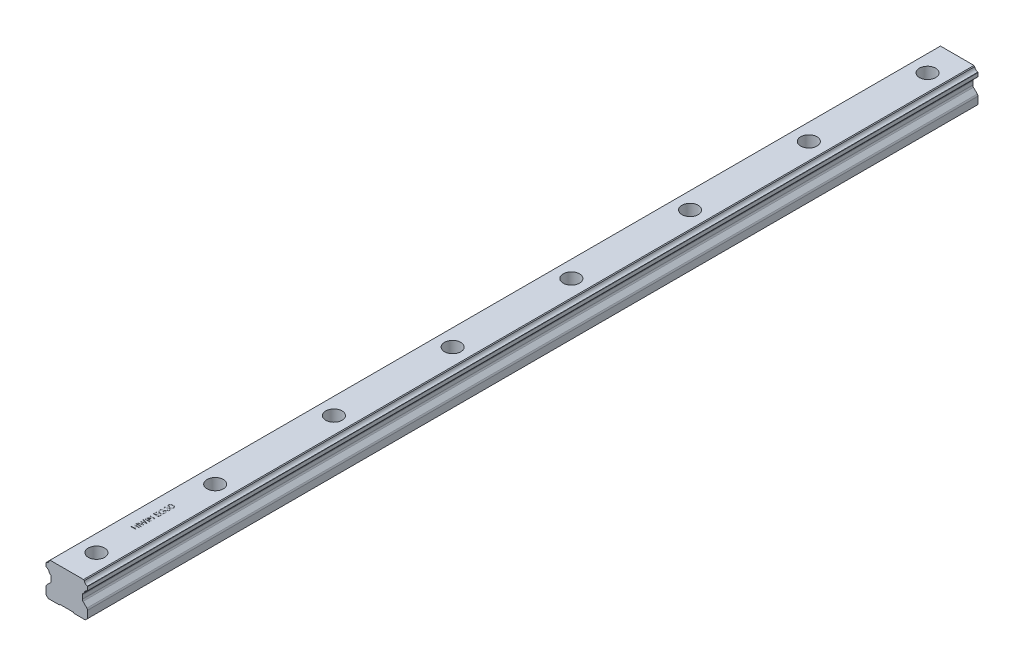
from build123d import *

# Parameters (mm, degrees)
EXTRUDE_1_DEPTH              = 600
HOLE_WIZARD_M6_1_D           = 7
HOLE_WIZARD_M6_1_CBORE_D     = 11
HOLE_WIZARD_M6_1_CBORE_DEPTH = 9
PATTERN_LINEAR_1_COUNT       = 8
PATTERN_LINEAR_1_PITCH       = 80
SKETCH_6_W                   = 3.5
SKETCH_6_H                   = 0.314102564
CUT_EXTRUDE_1_DEPTH          = 0.1


with BuildPart() as part:
    # 草图1 → 凸台-拉伸1 (new body)
    with BuildSketch(Plane.XY):
        with BuildLine():
            Line((-5, 0), (-4.5, 0.5))
            Line((-4.5, 0.5), (4.5, 0.5))
            Line((4.5, 0.5), (5, 0))
            Line((5, 0), (12.5, 0))
            Line((12.5, 0), (14, 1.5))
            Line((14, 1.5), (14, 6.378679656))
            ThreePointArc((14, 6.378679656), (13.885819299, 6.952704802), (13.56066018, 7.43933983))
            Line((13.56066018, 7.43933983), (10.939339837, 10.060660173))
            ThreePointArc((10.939339837, 10.060660173), (10.61418071, 10.547295197), (10.500000009, 11.121320345))
            Line((10.500000009, 11.121320345), (10.500000009, 13.578679658))
            ThreePointArc((10.500000009, 13.578679658), (10.614180701, 14.152704808), (10.939339828, 14.639339831))
            Line((10.939339828, 14.639339831), (11.758193653, 15.458193656))
            ThreePointArc((11.758193653, 15.458193656), (11.768448169, 15.468969732), (11.778155914, 15.480240872))
            ThreePointArc((11.778155914, 15.480240872), (12.478076595, 16.902541614), (13.892618036, 17.618014096))
            ThreePointArc((13.892618036, 17.618014096), (13.971832127, 17.721095866), (14, 17.848010383))
            Line((14, 17.848010383), (14, 20.151989624))
            ThreePointArc((14, 20.151989624), (13.971832127, 20.27890414), (13.892618036, 20.381985911))
            ThreePointArc((13.892618036, 20.381985911), (12.478076601, 21.097458394), (11.778155922, 22.519759133))
            ThreePointArc((11.778155922, 22.519759133), (11.768448178, 22.531030273), (11.758193661, 22.541806349))
            Line((11.758193661, 22.541806349), (11.300000009, 23.000000002))
            Line((11.300000009, 23.000000002), (-11.300000009, 23.000000002))
            Line((-11.300000009, 23.000000002), (-11.758193661, 22.541806349))
            ThreePointArc((-11.758193661, 22.541806349), (-11.768448178, 22.531030273), (-11.778155922, 22.519759133))
            ThreePointArc((-11.778155922, 22.519759133), (-12.478076604, 21.097458391), (-13.892618045, 20.381985909))
            ThreePointArc((-13.892618045, 20.381985909), (-13.971832136, 20.278904139), (-14.000000009, 20.151989622))
            Line((-14.000000009, 20.151989622), (-14.000000009, 17.848010381))
            ThreePointArc((-14.000000009, 17.848010381), (-13.971832136, 17.721095864), (-13.892618045, 17.618014094))
            ThreePointArc((-13.892618045, 17.618014094), (-12.478076604, 16.902541612), (-11.778155922, 15.480240871))
            ThreePointArc((-11.778155922, 15.480240871), (-11.768448178, 15.46896973), (-11.758193661, 15.458193654))
            Line((-11.758193661, 15.458193654), (-10.939339837, 14.63933983))
            ThreePointArc((-10.939339837, 14.63933983), (-10.61418071, 14.152704807), (-10.500000009, 13.578679658))
            Line((-10.500000009, 13.578679658), (-10.500000009, 11.121320345))
            ThreePointArc((-10.500000009, 11.121320345), (-10.614180701, 10.547295196), (-10.939339828, 10.060660172))
            Line((-10.939339828, 10.060660172), (-13.560660172, 7.439339828))
            ThreePointArc((-13.560660172, 7.439339828), (-13.885819299, 6.952704805), (-14, 6.378679656))
            Line((-14, 6.378679656), (-14, 1.5))
            Line((-14, 1.5), (-12.5, 0))
            Line((-12.5, 0), (-5, 0))
        make_face()
    extrude(amount=-EXTRUDE_1_DEPTH)

    # M6 六角凹头螺钉的柱形沉头孔1 (through all)
    with Locations(Plane(origin=(-2.187067447, 23.000000002, -4.078813807), x_dir=(-1, 0, 0), z_dir=(0, 1, 0))):
        with Locations((-2.187067447, -15.921186193)):
            hole_wizard_m6_1 = CounterBoreHole(HOLE_WIZARD_M6_1_D / 2, HOLE_WIZARD_M6_1_CBORE_D / 2, HOLE_WIZARD_M6_1_CBORE_DEPTH)

    # 阵列(线性)1: M6 六角凹头螺钉的柱形沉头孔1 ×8
    with Locations(*[(0, 0, -i * PATTERN_LINEAR_1_PITCH) for i in range(1, PATTERN_LINEAR_1_COUNT)]):
        add(hole_wizard_m6_1, mode=Mode.SUBTRACT)

    # 草图6 → 切除-拉伸1 (cut)
    # profile 1 of 9: a face of its own
    with BuildSketch(Plane(origin=(0, 23.000000002, 0), x_dir=(1, 0, 0), z_dir=(0, 1, 0))):
        Polygon((-3.5, 46.762820513), (-3.5, 47.076923077), (-2.064102564, 47.076923077), (-2.064102564, 48.871794872), (-3.5, 48.871794872), (-3.5, 49.185897436), (0, 49.185897436), (0, 48.871794872), (-1.705128205, 48.871794872), (-1.705128205, 47.076923077), (0, 47.076923077), (0, 46.762820513), align=None)
    # profile 2 of 9: a face of its own
    with BuildSketch(Plane(origin=(0, 23.000000002, 0), x_dir=(1, 0, 0), z_dir=(0, 1, 0))):
        with Locations((-1.75, 50.240384615)):
            Rectangle(SKETCH_6_W, SKETCH_6_H)
    # profile 3 of 9: a face of its own
    with BuildSketch(Plane(origin=(0, 23.000000002, 0), x_dir=(1, 0, 0), z_dir=(0, 1, 0))):
        Polygon((-3.5, 50.935897436), (-3.5, 51.260516827), (-0.933193109, 51.945512821), (-3.5, 52.964242788), (-3.5, 53.009815705), (-0.950721154, 54.009615385), (-3.5, 54.698116987), (-3.5, 55.019230769), (0, 54.075520833), (0, 54.030649038), (-2.676883013, 52.977564103), (0, 51.911858974), (0, 51.866987179), align=None)
    # profile 4 of 9: a face of its own
    with BuildSketch(Plane(origin=(0, 23.000000002, 0), x_dir=(1, 0, 0), z_dir=(0, 1, 0))):
        with Locations((-1.75, 55.983974359)):
            Rectangle(SKETCH_6_W, SKETCH_6_H)
    # profile 5 of 9: a face of its own
    with BuildSketch(Plane(origin=(0, 23.000000002, 0), x_dir=(1, 0, 0), z_dir=(0, 1, 0))):
        Polygon((0, 56.903846154), (-3.5, 56.903846154), (-3.5, 56.969751603), (-0.745292468, 59.282051282), (-3.5, 59.282051282), (-3.5, 59.596153846), (0, 59.596153846), (0, 59.524639423), (-2.748397436, 57.217948718), (0, 57.217948718), align=None)
    # profile 6 of 9: a face of its own
    with BuildSketch(Plane(origin=(0, 23.000000002, 0), x_dir=(1, 0, 0), z_dir=(0, 1, 0))):
        Polygon((-3.5, 61.83974359), (-3.5, 63.814102564), (-3.141025641, 63.814102564), (-3.141025641, 62.153846154), (-2.064102564, 62.153846154), (-2.064102564, 63.814102564), (-1.705128205, 63.814102564), (-1.705128205, 62.153846154), (-0.358974359, 62.153846154), (-0.358974359, 63.814102564), (0, 63.814102564), (0, 61.83974359), align=None)
    # profile 7 of 9: a face of its own
    with BuildSketch(Plane(origin=(0, 23.000000002, 0), x_dir=(1, 0, 0), z_dir=(0, 1, 0))):
        with BuildLine():
            Line((-2.902644231, 67.717948718), (-2.647435897, 67.448717949))
            add(Edge.make_bspline(
                [(-2.647435897, 67.448717949), (-2.69328212, 67.400008868), (-2.783881335, 67.303752203), (-2.901244074, 67.146552261), (-3.002777003, 66.983196408), (-3.084772592, 66.813420508), (-3.149094254, 66.641676508), (-3.195850217, 66.470917554), (-3.225460377, 66.302249256), (-3.229016796, 66.190084954), (-3.230769231, 66.134815705)],
                knots=[0, 0, 0, 0, 1.089067066, 2.152164705, 3.18986567, 4.218445106, 5.218487318, 6.173592265, 7.100032889, 8, 8, 8, 8], degree=3))
            add(Edge.make_bspline(
                [(-3.230769231, 66.134815705), (-3.230355625, 66.100901005), (-3.229529486, 66.033159565), (-3.218985271, 65.932537621), (-3.203820407, 65.832970983), (-3.181878529, 65.734647609), (-3.15406947, 65.637376321), (-3.119284004, 65.541495434), (-3.078728771, 65.446826062), (-3.031866252, 65.354260043), (-2.980386575, 65.26451931), (-2.923337414, 65.179763314), (-2.862550889, 65.099446852), (-2.796491613, 65.025097645), (-2.725807311, 64.956221131), (-2.651770944, 64.89155043), (-2.572926872, 64.832290852), (-2.489599321, 64.779505212), (-2.403726867, 64.731837618), (-2.316037795, 64.690645418), (-2.227346143, 64.654835464), (-2.136984078, 64.627561503), (-2.045883197, 64.604460629), (-1.953566086, 64.588379393), (-1.859791669, 64.579283076), (-1.796993971, 64.577712585), (-1.765424679, 64.576923077)],
                knots=[0, 0, 0, 0, 1.028150113, 2.053633673, 3.06513288, 4.081487945, 5.106702018, 6.131327874, 7.172780699, 8.228344599, 9.276313556, 10.308389736, 11.324843658, 12.329040066, 13.321460474, 14.316307835, 15.308626991, 16.309440696, 17.305625405, 18.28535951, 19.246194545, 20.203493668, 21.145557131, 22.095268976, 23.042464743, 24, 24, 24, 24], degree=3))
            add(Edge.make_bspline(
                [(-1.765424679, 64.576923077), (-1.733154018, 64.577679272), (-1.668700816, 64.579189598), (-1.572504414, 64.588842795), (-1.477747832, 64.606798005), (-1.384282029, 64.630609755), (-1.291920993, 64.66088243), (-1.20076111, 64.698074944), (-1.110811241, 64.742381076), (-1.022964324, 64.793552345), (-0.937464192, 64.850061813), (-0.856251713, 64.912212997), (-0.780271995, 64.980110534), (-0.708415252, 65.052509477), (-0.641134974, 65.130069473), (-0.579242122, 65.213543005), (-0.521779643, 65.301761597), (-0.469378807, 65.394764386), (-0.42257144, 65.491568366), (-0.38094723, 65.590824797), (-0.346667976, 65.692852699), (-0.31872985, 65.797115365), (-0.295829559, 65.903488643), (-0.281097077, 66.012512444), (-0.270406246, 66.123385153), (-0.269624576, 66.198123785), (-0.269230769, 66.235777244)],
                knots=[0, 0, 0, 0, 0.935915162, 1.869274651, 2.799799983, 3.730201895, 4.664668062, 5.616159355, 6.583070886, 7.570012957, 8.562524459, 9.553461134, 10.53281078, 11.515274572, 12.509912756, 13.507571325, 14.526460018, 15.561318395, 16.601025881, 17.643204557, 18.680545676, 19.719612342, 20.772381578, 21.833430283, 22.908478249, 24, 24, 24, 24], degree=3))
            add(Edge.make_bspline(
                [(-0.269230769, 66.235777244), (-0.270178952, 66.281155776), (-0.272040863, 66.370263896), (-0.286546735, 66.501247716), (-0.309173205, 66.627060334), (-0.342412256, 66.747292172), (-0.384484705, 66.862379567), (-0.436513285, 66.971898055), (-0.497950569, 67.076150049), (-0.567552463, 67.174684309), (-0.645100929, 67.26515833), (-0.728035637, 67.347500409), (-0.817431068, 67.418879031), (-0.911954918, 67.481426348), (-1.012511326, 67.533123592), (-1.118540888, 67.57556947), (-1.230109213, 67.608101926), (-1.307200733, 67.621457015), (-1.346153846, 67.628205128)],
                knots=[0, 0, 0, 0, 1.130199668, 2.219330667, 3.279027493, 4.311506524, 5.322739849, 6.327972234, 7.327472899, 8.33386792, 9.329086447, 10.29244429, 11.240784345, 12.174119183, 13.111530729, 14.052100829, 15.015757696, 16, 16, 16, 16], degree=3))
            Line((-1.346153846, 67.628205128), (-1.346153846, 66.461538462))
            Line((-1.346153846, 66.461538462), (-1.705128205, 66.461538462))
            Line((-1.705128205, 66.461538462), (-1.705128205, 67.942307692))
            add(Edge.make_bspline(
                [(-1.705128205, 67.942307692), (-1.638220716, 67.940601844), (-1.507270675, 67.937263191), (-1.316300404, 67.913844275), (-1.13592871, 67.876027763), (-0.965965639, 67.824367451), (-0.806652046, 67.75749217), (-0.65782618, 67.676119642), (-0.520449499, 67.578947521), (-0.393400495, 67.469437079), (-0.280071283, 67.346537122), (-0.180465345, 67.213568502), (-0.09656273, 67.070311533), (-0.028302067, 66.916901726), (0.024971927, 66.753841292), (0.062743504, 66.580752913), (0.085373467, 66.397871312), (0.088264847, 66.272534635), (0.08974359, 66.208433494)],
                knots=[0, 0, 0, 0, 1.140356446, 2.231883559, 3.274166699, 4.278491846, 5.25512956, 6.21435461, 7.1637429, 8.11826594, 9.068280886, 10.0076534, 10.945064095, 11.891975133, 12.864533718, 13.863980011, 14.907571808, 16, 16, 16, 16], degree=3))
            add(Edge.make_bspline(
                [(0.08974359, 66.208433494), (0.089174469, 66.168923358), (0.088051978, 66.090996637), (0.080074631, 65.975905709), (0.067794054, 65.863988089), (0.049248931, 65.75526008), (0.026534277, 65.649321738), (-0.002552442, 65.546702153), (-0.036221141, 65.447010411), (-0.074516815, 65.350092425), (-0.118888472, 65.256827878), (-0.168198111, 65.166801361), (-0.222191472, 65.079515236), (-0.281802318, 64.995564071), (-0.346584778, 64.914510449), (-0.416668697, 64.836877005), (-0.491839816, 64.762229127), (-0.545218826, 64.715468664), (-0.572115385, 64.691907051)],
                knots=[0, 0, 0, 0, 1.107784379, 2.184907829, 3.233506516, 4.263428166, 5.276301166, 6.270063455, 7.25232949, 8.225834625, 9.190232166, 10.146266622, 11.1027726, 12.066435141, 13.031522626, 14.010570082, 14.99756817, 16, 16, 16, 16], degree=3))
            add(Edge.make_bspline(
                [(-0.572115385, 64.691907051), (-0.614786038, 64.657721119), (-0.699419055, 64.589916707), (-0.835018999, 64.50263855), (-0.975420859, 64.428237147), (-1.121015488, 64.367869325), (-1.271666701, 64.320731239), (-1.427181992, 64.286924986), (-1.587761622, 64.267117697), (-1.696426887, 64.264264159), (-1.751402244, 64.262820513)],
                knots=[0, 0, 0, 0, 1.023165419, 2.029347347, 3.013907458, 3.994755782, 4.975994455, 5.96558838, 6.970761222, 8, 8, 8, 8], degree=3))
            add(Edge.make_bspline(
                [(-1.751402244, 64.262820513), (-1.792568496, 64.263352751), (-1.874377804, 64.264410462), (-1.99583511, 64.27723598), (-2.115135808, 64.295637392), (-2.232182344, 64.322684468), (-2.347053012, 64.356780654), (-2.45980069, 64.399334435), (-2.570493643, 64.448878213), (-2.67836343, 64.50646793), (-2.782003044, 64.570536667), (-2.880905313, 64.640144323), (-2.973467332, 64.715828008), (-3.059903521, 64.797808103), (-3.141494975, 64.884432033), (-3.216537375, 64.977518334), (-3.286205011, 65.07565667), (-3.349159221, 65.17960781), (-3.405727075, 65.287731441), (-3.455315154, 65.399792527), (-3.496298775, 65.515750345), (-3.531072472, 65.634737902), (-3.556787635, 65.757655381), (-3.575436374, 65.883610924), (-3.588196976, 66.013261034), (-3.589223231, 66.100897064), (-3.58974359, 66.145332532)],
                knots=[0, 0, 0, 0, 1.00895651, 2.005089799, 2.991467152, 3.967318338, 4.948153826, 5.927364234, 6.919980553, 7.91976625, 8.923240147, 9.905815003, 10.88314567, 11.851989312, 12.825009789, 13.798721852, 14.781296708, 15.773896486, 16.776076962, 17.771600213, 18.775744723, 19.78957137, 20.808953803, 21.851964491, 22.910847925, 24, 24, 24, 24], degree=3))
            add(Edge.make_bspline(
                [(-3.58974359, 66.145332532), (-3.589164098, 66.181570776), (-3.588015034, 66.253426954), (-3.580050386, 66.360352687), (-3.567426505, 66.465625701), (-3.550199718, 66.569402091), (-3.526736028, 66.671328458), (-3.498657743, 66.771695163), (-3.46596592, 66.870647699), (-3.426977074, 66.967875948), (-3.382723449, 67.064033664), (-3.332910027, 67.159655505), (-3.276685022, 67.254414751), (-3.213881487, 67.348475732), (-3.145578069, 67.44243159), (-3.069821245, 67.534796233), (-2.989598489, 67.627799177), (-2.931916305, 67.687600991), (-2.902644231, 67.717948718)],
                knots=[0, 0, 0, 0, 0.985871117, 1.954866573, 2.915460327, 3.869826059, 4.81536089, 5.759505086, 6.70452669, 7.649098992, 8.607881297, 9.583363685, 10.581137262, 11.603961102, 12.659522466, 13.73993555, 14.853081303, 16, 16, 16, 16], degree=3))
        make_face()
    # profile 8 of 9: a face of its own
    with BuildSketch(Plane(origin=(0, 23.000000002, 0), x_dir=(1, 0, 0), z_dir=(0, 1, 0))):
        with BuildLine():
            Line((-2.692307692, 68.794871795), (-2.692307692, 68.480769231))
            add(Edge.make_bspline(
                [(-2.692307692, 68.480769231), (-2.727540176, 68.489278781), (-2.796416801, 68.505914257), (-2.894824062, 68.54061183), (-2.987947583, 68.578411086), (-3.074043657, 68.62380019), (-3.154842559, 68.673308944), (-3.228511684, 68.730031666), (-3.296924649, 68.791351389), (-3.357637887, 68.859176338), (-3.412615616, 68.930305), (-3.459490673, 69.005739619), (-3.499814826, 69.083962513), (-3.533035058, 69.165515646), (-3.558060582, 69.250641818), (-3.576217387, 69.338571441), (-3.588008502, 69.429534941), (-3.589159265, 69.491282532), (-3.58974359, 69.522636218)],
                knots=[0, 0, 0, 0, 1.162005537, 2.271625781, 3.343758855, 4.383309926, 5.390229558, 6.379919256, 7.361854164, 8.333198761, 9.295911338, 10.242430842, 11.177959212, 12.116337295, 13.062827104, 14.020064771, 14.994644689, 16, 16, 16, 16], degree=3))
            add(Edge.make_bspline(
                [(-3.58974359, 69.522636218), (-3.588364359, 69.56831896), (-3.585635984, 69.658687971), (-3.560721548, 69.791451018), (-3.521296415, 69.919477837), (-3.466822688, 70.041367085), (-3.399635375, 70.154585517), (-3.319670638, 70.255321704), (-3.228471337, 70.342210215), (-3.127738772, 70.415104593), (-3.020083263, 70.472179592), (-2.909283106, 70.514265965), (-2.795601134, 70.539887646), (-2.718843855, 70.543208203), (-2.680388622, 70.544871795)],
                knots=[0, 0, 0, 0, 1.083050992, 2.142477498, 3.193116406, 4.255571735, 5.30263384, 6.308962982, 7.297363603, 8.282367274, 9.249857812, 10.179914175, 11.08814088, 12, 12, 12, 12], degree=3))
            add(Edge.make_bspline(
                [(-2.680388622, 70.544871795), (-2.643381827, 70.543708204), (-2.570965273, 70.541431237), (-2.465243775, 70.522097531), (-2.365602175, 70.489561268), (-2.271621013, 70.444491506), (-2.183896173, 70.386149955), (-2.102230282, 70.315477259), (-2.026261124, 70.231974597), (-1.982741651, 70.168695659), (-1.960336538, 70.136117788)],
                knots=[0, 0, 0, 0, 1.024540389, 2.004866551, 2.965041327, 3.920577974, 4.882998113, 5.874504559, 6.905732034, 8, 8, 8, 8], degree=3))
            add(Edge.make_bspline(
                [(-1.960336538, 70.136117788), (-1.942423541, 70.173397), (-1.906875194, 70.247377602), (-1.836051735, 70.347199024), (-1.75628694, 70.439197511), (-1.693344586, 70.489900293), (-1.661658654, 70.515424679)],
                knots=[0, 0, 0, 0, 1.015663554, 2.015584519, 3.001021554, 4, 4, 4, 4], degree=3))
            add(Edge.make_bspline(
                [(-1.661658654, 70.515424679), (-1.638600902, 70.532266022), (-1.592862986, 70.565672918), (-1.51932656, 70.606908452), (-1.444975071, 70.644317566), (-1.367815664, 70.673467785), (-1.288742651, 70.696041652), (-1.207620255, 70.712177684), (-1.124382232, 70.722201825), (-1.068069752, 70.723637377), (-1.039763622, 70.724358974)],
                knots=[0, 0, 0, 0, 1.025084078, 2.033381695, 3.024893161, 4.013698104, 4.991890475, 5.976764909, 6.982997093, 8, 8, 8, 8], degree=3))
            add(Edge.make_bspline(
                [(-1.039763622, 70.724358974), (-0.990754151, 70.722564202), (-0.892965849, 70.718983104), (-0.74848737, 70.686982909), (-0.60727652, 70.637354543), (-0.47214511, 70.566956002), (-0.345832955, 70.480771863), (-0.231982837, 70.379372435), (-0.135655914, 70.261308087), (-0.054197152, 70.130857678), (0.01031173, 69.988918727), (0.056807387, 69.837723782), (0.084695443, 69.678147828), (0.088041716, 69.56902181), (0.08974359, 69.513521635)],
                knots=[0, 0, 0, 0, 0.955697303, 1.906897079, 2.875188111, 3.870982192, 4.871999088, 5.854111427, 6.836107184, 7.836239895, 8.848948182, 9.870701427, 10.917064451, 12, 12, 12, 12], degree=3))
            add(Edge.make_bspline(
                [(0.08974359, 69.513521635), (0.088867804, 69.47610469), (0.087144549, 69.402480619), (0.075573795, 69.294203576), (0.053866216, 69.191067092), (0.02656593, 69.092069671), (-0.011179774, 68.998705424), (-0.056179646, 68.909631395), (-0.109587649, 68.825238025), (-0.171493598, 68.7460265), (-0.240788051, 68.672081446), (-0.318622183, 68.60528674), (-0.403543338, 68.544903367), (-0.496315397, 68.491314997), (-0.596678518, 68.444296096), (-0.705034874, 68.404858517), (-0.820544439, 68.370424638), (-0.901018589, 68.354383909), (-0.942307692, 68.346153846)],
                knots=[0, 0, 0, 0, 1.048603596, 2.063302207, 3.045874044, 3.999447474, 4.937100059, 5.862643889, 6.7929026, 7.7308982, 8.676022965, 9.627908155, 10.600123445, 11.591992905, 12.626222643, 13.701663232, 14.820785756, 16, 16, 16, 16], degree=3))
            Line((-0.942307692, 68.346153846), (-0.942307692, 68.66025641))
            add(Edge.make_bspline(
                [(-0.942307692, 68.66025641), (-0.915358679, 68.668439702), (-0.862940507, 68.684356914), (-0.787500202, 68.711451212), (-0.718342149, 68.742319484), (-0.654959027, 68.775434043), (-0.596726624, 68.810212489), (-0.545184755, 68.849127414), (-0.498069553, 68.889296559), (-0.471524941, 68.919575913), (-0.458533654, 68.934395032)],
                knots=[0, 0, 0, 0, 1.198163088, 2.33053128, 3.407730985, 4.417276592, 5.372219308, 6.28897303, 7.162600585, 8, 8, 8, 8], degree=3))
            add(Edge.make_bspline(
                [(-0.458533654, 68.934395032), (-0.44343155, 68.953993797), (-0.413273959, 68.993130831), (-0.374678832, 69.056866213), (-0.341642326, 69.124130831), (-0.31478887, 69.195485626), (-0.294631697, 69.270940169), (-0.280123513, 69.350188385), (-0.270545857, 69.4333603), (-0.269675525, 69.490123508), (-0.269230769, 69.519130609)],
                knots=[0, 0, 0, 0, 0.946083416, 1.889246487, 2.84504177, 3.809995578, 4.801312957, 5.829064617, 6.89060985, 8, 8, 8, 8], degree=3))
            add(Edge.make_bspline(
                [(-0.269230769, 69.519130609), (-0.269846674, 69.551884112), (-0.271051024, 69.615930759), (-0.282126731, 69.709385618), (-0.298257144, 69.798293065), (-0.323170127, 69.881665991), (-0.353950979, 69.960596499), (-0.392599384, 70.033978148), (-0.437944106, 70.102774254), (-0.489483264, 70.16610366), (-0.545904759, 70.223049167), (-0.60491783, 70.273188681), (-0.66627366, 70.315813342), (-0.730311781, 70.35019692), (-0.79676701, 70.377347471), (-0.865825839, 70.395830671), (-0.936923105, 70.408682186), (-0.985252074, 70.409728798), (-1.009615385, 70.41025641)],
                knots=[0, 0, 0, 0, 1.217147791, 2.380027433, 3.494444702, 4.572153297, 5.609568379, 6.639424714, 7.649109417, 8.668170816, 9.669597737, 10.625200337, 11.543417969, 12.441394052, 13.322311151, 14.205496177, 15.095365482, 16, 16, 16, 16], degree=3))
            add(Edge.make_bspline(
                [(-1.009615385, 70.41025641), (-1.042224638, 70.408722889), (-1.107280885, 70.405663476), (-1.2030297, 70.382403129), (-1.295316283, 70.343798747), (-1.38294536, 70.290813502), (-1.463170576, 70.224736885), (-1.535262402, 70.148692921), (-1.594692546, 70.060612827), (-1.635791228, 69.979605975), (-1.663826853, 69.907838935), (-1.68250216, 69.846423995), (-1.698315711, 69.777667256), (-1.713028014, 69.702400949), (-1.725549353, 69.62005772), (-1.735991171, 69.530727286), (-1.744346211, 69.434391523), (-1.748077307, 69.367700357), (-1.75, 69.333333333)],
                knots=[0, 0, 0, 0, 1.070505987, 2.135685285, 3.216438728, 4.346150463, 5.486482244, 6.621737109, 7.7759408, 8.963942283, 9.59839197, 10.305095457, 11.070459627, 11.915156775, 12.823989992, 13.805807174, 14.869297358, 16, 16, 16, 16], degree=3))
            Line((-1.75, 69.333333333), (-2.108974359, 69.333333333))
            add(Edge.make_bspline(
                [(-2.108974359, 69.333333333), (-2.109815076, 69.376618851), (-2.111461258, 69.461374898), (-2.127376172, 69.585509629), (-2.152925868, 69.703708266), (-2.189431972, 69.814271673), (-2.232431754, 69.914851665), (-2.282116815, 70.002463399), (-2.338352279, 70.074800462), (-2.400061459, 70.132618581), (-2.465885585, 70.176564414), (-2.534911696, 70.208168986), (-2.607413433, 70.227005339), (-2.65691109, 70.229510182), (-2.681790865, 70.230769231)],
                knots=[0, 0, 0, 0, 1.322091412, 2.58874672, 3.817242262, 5.011895168, 6.140903042, 7.155122731, 8.080855046, 8.929742606, 9.727943956, 10.488587771, 11.240295418, 12, 12, 12, 12], degree=3))
            add(Edge.make_bspline(
                [(-2.681790865, 70.230769231), (-2.700071652, 70.230363889), (-2.73644041, 70.229557481), (-2.789741053, 70.218983439), (-2.841409956, 70.203824429), (-2.890858006, 70.181815369), (-2.938186405, 70.153299227), (-2.983914344, 70.118903157), (-3.027450953, 70.077646858), (-3.069020841, 70.031439356), (-3.106837935, 69.980272576), (-3.13993415, 69.925340063), (-3.168009957, 69.866864563), (-3.191238499, 69.805220651), (-3.208692545, 69.740121061), (-3.221229855, 69.671895641), (-3.229067101, 69.600407641), (-3.230195574, 69.551635953), (-3.230769231, 69.526842949)],
                knots=[0, 0, 0, 0, 0.884325644, 1.759323928, 2.622595547, 3.489424008, 4.37295195, 5.294616785, 6.255907374, 7.274251867, 8.302369084, 9.333474657, 10.37669385, 11.44084034, 12.520297356, 13.637342342, 14.798947025, 16, 16, 16, 16], degree=3))
            add(Edge.make_bspline(
                [(-3.230769231, 69.526842949), (-3.229377869, 69.486991281), (-3.226660215, 69.409151704), (-3.202857202, 69.296936787), (-3.164879118, 69.192617453), (-3.119546099, 69.112878787), (-3.074795665, 69.053996213), (-3.035713279, 69.011919274), (-2.992280455, 68.970598764), (-2.94182208, 68.932753087), (-2.887755289, 68.894479111), (-2.827331608, 68.859634549), (-2.762127214, 68.825774857), (-2.716031579, 68.805372307), (-2.692307692, 68.794871795)],
                knots=[0, 0, 0, 0, 1.472543308, 2.876219568, 4.221790263, 5.565193594, 6.249813518, 6.953379497, 7.687249741, 8.463570142, 9.283606569, 10.136032583, 11.040678096, 12, 12, 12, 12], degree=3))
        make_face()
    # profile 9 of 9: a face of its own
    with BuildSketch(Plane(origin=(0, 23.000000002, 0), x_dir=(1, 0, 0), z_dir=(0, 1, 0))):
        with BuildLine():
            add(Edge.make_bspline(
                [(-1.748597756, 71.038461538), (-1.804695144, 71.038789557), (-1.913665128, 71.039426737), (-2.07244977, 71.046515158), (-2.22141006, 71.0582905), (-2.360553125, 71.074427873), (-2.489914892, 71.094065851), (-2.609149641, 71.120281345), (-2.718809275, 71.150094123), (-2.819251231, 71.184646654), (-2.911829251, 71.223634148), (-2.998253337, 71.266069447), (-3.078399222, 71.31363056), (-3.153522881, 71.363620634), (-3.222476964, 71.417985777), (-3.286055953, 71.475560296), (-3.343723673, 71.537495691), (-3.395519616, 71.603191243), (-3.4409371, 71.672201705), (-3.481188747, 71.742641277), (-3.514343815, 71.81576856), (-3.541465573, 71.890620872), (-3.56360569, 71.967355975), (-3.578813682, 72.045954279), (-3.588365511, 72.12659798), (-3.589279872, 72.181029096), (-3.58974359, 72.208633814)],
                knots=[0, 0, 0, 0, 1.646148282, 3.197666765, 4.66315463, 6.030252048, 7.307778049, 8.501004361, 9.610818041, 10.641065266, 11.615491391, 12.557119604, 13.464013759, 14.348536654, 15.203310953, 16.038349431, 16.863300206, 17.683791446, 18.490318933, 19.285717724, 20.06220424, 20.843281102, 21.620494212, 22.403315558, 23.190242141, 24, 24, 24, 24], degree=3))
            add(Edge.make_bspline(
                [(-3.58974359, 72.208633814), (-3.58935734, 72.236482792), (-3.588588839, 72.291892456), (-3.57777172, 72.373517604), (-3.563809751, 72.453720982), (-3.541417054, 72.531285744), (-3.514621286, 72.607678494), (-3.479264697, 72.680999494), (-3.440811661, 72.753837366), (-3.393902192, 72.822883181), (-3.342059509, 72.890199903), (-3.283204809, 72.953302301), (-3.218966904, 73.013803442), (-3.1479131, 73.069418221), (-3.071132863, 73.12253021), (-2.987982553, 73.171123224), (-2.898646443, 73.21620791), (-2.803538681, 73.25863174), (-2.700118793, 73.295730259), (-2.589031834, 73.328713808), (-2.46927186, 73.355749407), (-2.341506009, 73.378107373), (-2.20510133, 73.39546141), (-2.060334196, 73.408091385), (-1.907114038, 73.414765228), (-1.802356156, 73.416021823), (-1.748597756, 73.416666667)],
                knots=[0, 0, 0, 0, 0.810910589, 1.61342667, 2.396193133, 3.181089899, 3.963115317, 4.752255436, 5.550715454, 6.36105385, 7.181178335, 8.024612154, 8.872680183, 9.750181803, 10.651284446, 11.591556747, 12.554036451, 13.566402641, 14.62422919, 15.753422176, 16.94128843, 18.199818041, 19.531985927, 20.947085226, 22.433341622, 24, 24, 24, 24], degree=3))
            add(Edge.make_bspline(
                [(-1.748597756, 73.416666667), (-1.695074317, 73.416007636), (-1.590552634, 73.414720666), (-1.438014706, 73.40823452), (-1.294027899, 73.395152918), (-1.1584387, 73.379028197), (-1.031184245, 73.356420339), (-0.912347453, 73.329179739), (-0.801507589, 73.298143127), (-0.699458804, 73.260475246), (-0.604516084, 73.219038865), (-0.515836856, 73.174002558), (-0.432708505, 73.125683762), (-0.355725748, 73.073368329), (-0.284957142, 73.016838744), (-0.220498913, 72.956380009), (-0.161269873, 72.892726653), (-0.108856037, 72.825017487), (-0.061589422, 72.755328552), (-0.021740947, 72.68248328), (0.012785419, 72.608345979), (0.041013907, 72.532176457), (0.06290543, 72.454092315), (0.07795466, 72.373833966), (0.088533112, 72.291880937), (0.0893387, 72.236478939), (0.08974359, 72.208633814)],
                knots=[0, 0, 0, 0, 1.561645053, 3.049612875, 4.452756685, 5.778837748, 7.032101753, 8.221335837, 9.334924186, 10.387562255, 11.392109817, 12.355697819, 13.287721948, 14.19548756, 15.068665045, 15.927346723, 16.771751757, 17.602390507, 18.423119567, 19.225778204, 20.022010933, 20.807278863, 21.593079439, 22.384715467, 23.188155646, 24, 24, 24, 24], degree=3))
            add(Edge.make_bspline(
                [(0.08974359, 72.208633814), (0.089277234, 72.1810297), (0.088357672, 72.126599775), (0.078843941, 72.04594735), (0.063548437, 71.967664907), (0.042131835, 71.89136615), (0.015916991, 71.816659647), (-0.018236662, 71.744563315), (-0.057570846, 71.674275802), (-0.10236583, 71.605983597), (-0.153689187, 71.540973915), (-0.210447097, 71.478865865), (-0.274095026, 71.421277148), (-0.343630904, 71.3673834), (-0.418866334, 71.316864841), (-0.499851805, 71.269714719), (-0.586725603, 71.22638952), (-0.680035274, 71.186735931), (-0.781190123, 71.151578599), (-0.891129288, 71.120643581), (-1.010969427, 71.095936731), (-1.140102086, 71.074993857), (-1.278789653, 71.058212058), (-1.427082304, 71.046520047), (-1.584698442, 71.039432118), (-1.692967691, 71.038790969), (-1.748597756, 71.038461538)],
                knots=[0, 0, 0, 0, 0.810927267, 1.598990287, 2.382942141, 3.152806972, 3.926217614, 4.706701772, 5.493896336, 6.292070767, 7.104102563, 7.925577746, 8.761822141, 9.623241997, 10.509042271, 11.423174113, 12.375371989, 13.360203808, 14.400680605, 15.520553799, 16.714061498, 17.994519714, 19.364400916, 20.818312473, 22.365209998, 24, 24, 24, 24], degree=3))
        make_face()
        with BuildLine():
            add(Edge.make_bspline(
                [(-1.75, 71.352564103), (-1.703251488, 71.352686169), (-1.612521806, 71.352923075), (-1.480908982, 71.358932983), (-1.357947449, 71.367298161), (-1.243685198, 71.377822037), (-1.138521571, 71.393583038), (-1.042019366, 71.411464856), (-0.954357206, 71.432913007), (-0.874769028, 71.45841515), (-0.802127831, 71.487464572), (-0.73449747, 71.519125749), (-0.6710764, 71.553440253), (-0.612018488, 71.591111456), (-0.558045653, 71.632884146), (-0.507789808, 71.676821734), (-0.462998805, 71.724903585), (-0.409270042, 71.79140437), (-0.353751809, 71.879202241), (-0.305405447, 71.989822275), (-0.275023059, 72.103490831), (-0.271159294, 72.180642067), (-0.269230769, 72.219150641)],
                knots=[0, 0, 0, 0, 1.459098681, 2.831824031, 4.11146945, 5.306290378, 6.412266529, 7.42953815, 8.369053297, 9.227277979, 10.03601793, 10.809473603, 11.557037441, 12.285528272, 12.993193355, 13.685654407, 14.36688038, 15.041354379, 16.352855396, 17.594313975, 18.799247529, 20, 20, 20, 20], degree=3))
            add(Edge.make_bspline(
                [(-0.269230769, 72.219150641), (-0.270919423, 72.257882126), (-0.274290741, 72.335207707), (-0.303714275, 72.448771848), (-0.351547596, 72.558108334), (-0.406196032, 72.64439553), (-0.458572725, 72.709859129), (-0.503177405, 72.756780024), (-0.553136043, 72.799840987), (-0.607034569, 72.840683364), (-0.665907268, 72.878142355), (-0.729469782, 72.912205517), (-0.797898977, 72.943288858), (-0.845668714, 72.960997905), (-0.870092147, 72.970052083)],
                knots=[0, 0, 0, 0, 1.353621445, 2.702441307, 4.075953605, 5.516772412, 6.261413105, 7.007624062, 7.778524365, 8.566925914, 9.372323995, 10.217594641, 11.088702136, 12, 12, 12, 12], degree=3))
            add(Edge.make_bspline(
                [(-0.870092147, 72.970052083), (-0.901321887, 72.980603851), (-0.964731651, 73.002028465), (-1.063095303, 73.029640239), (-1.166298067, 73.051385638), (-1.273723184, 73.070949004), (-1.386162885, 73.08430206), (-1.503269269, 73.095049873), (-1.625130631, 73.10138056), (-1.707925622, 73.102165311), (-1.75, 73.102564103)],
                knots=[0, 0, 0, 0, 0.884706709, 1.796334032, 2.740027952, 3.714592787, 4.726048262, 5.777819803, 6.87074269, 8, 8, 8, 8], degree=3))
            add(Edge.make_bspline(
                [(-1.75, 73.102564103), (-1.792067573, 73.102013913), (-1.874360737, 73.100937626), (-1.994878918, 73.096823638), (-2.109346679, 73.086200064), (-2.218257151, 73.074400944), (-2.321007456, 73.057003725), (-2.418457753, 73.03824591), (-2.509400806, 73.013044726), (-2.59526029, 72.986124855), (-2.675061285, 72.955314791), (-2.749173893, 72.921397912), (-2.817962738, 72.885180157), (-2.88121528, 72.845823923), (-2.939298414, 72.803877404), (-2.990875649, 72.757836632), (-3.038455934, 72.710625539), (-3.091796946, 72.643481412), (-3.146613642, 72.55629272), (-3.19568703, 72.447052163), (-3.224729986, 72.333992895), (-3.228757601, 72.257403791), (-3.230769231, 72.219150641)],
                knots=[0, 0, 0, 0, 1.313483664, 2.569454835, 3.763100662, 4.901599063, 5.988328865, 7.015709358, 7.99797933, 8.932480776, 9.824041341, 10.666387587, 11.475829342, 12.24921787, 12.990555181, 13.709176526, 14.405678811, 15.080244297, 16.38186033, 17.610124501, 18.806354173, 20, 20, 20, 20], degree=3))
            add(Edge.make_bspline(
                [(-3.230769231, 72.219150641), (-3.228752596, 72.180434169), (-3.224715652, 72.102930691), (-3.195821345, 71.988664056), (-3.146757221, 71.878685513), (-3.091902557, 71.791209305), (-3.038660449, 71.724880866), (-2.993345284, 71.677812651), (-2.944289777, 71.633265708), (-2.889838141, 71.592574718), (-2.830988321, 71.555126894), (-2.768387395, 71.519486257), (-2.700630668, 71.488248474), (-2.628046431, 71.459105789), (-2.548453875, 71.433561109), (-2.460474524, 71.412358028), (-2.363741864, 71.39305513), (-2.257809852, 71.379153897), (-2.143523214, 71.366912938), (-2.020247228, 71.359024818), (-1.888182457, 71.352895544), (-1.796983355, 71.352676796), (-1.75, 71.352564103)],
                knots=[0, 0, 0, 0, 1.207546505, 2.417292871, 3.651582144, 4.952510111, 5.626719005, 6.30238548, 6.989136872, 7.692112372, 8.420316868, 9.164734959, 9.937886623, 10.746308695, 11.604196049, 12.543341915, 13.568754172, 14.680483261, 15.875568977, 17.154711427, 18.534182925, 20, 20, 20, 20], degree=3))
        make_face(mode=Mode.SUBTRACT)
    extrude(amount=-CUT_EXTRUDE_1_DEPTH, mode=Mode.SUBTRACT)


solid = part.part
